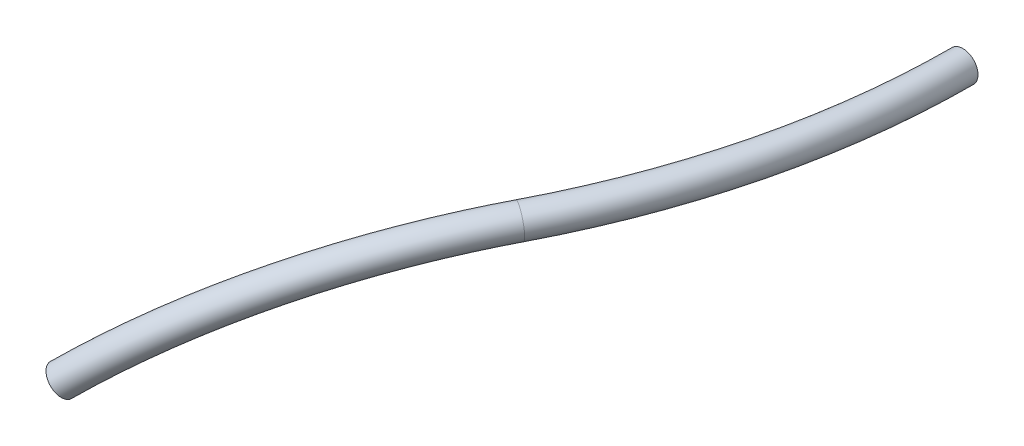
from build123d import *

# Parameters (mm, degrees)
SKETCH1_R = 50.8
SKETCH4_R = 50.8


with BuildPart() as part:
    # Sweep1: sweep along a path in Sketch2
    with BuildLine(Plane(origin=(-767.916933237, 6367.64298763, -2.775e-06), x_dir=(5.179307759717874e-11, -4.294733297799064e-10, -1.0), z_dir=(0.11972922919226148, -0.9928065832159992, 4.325850943793921e-10))) as sweep1_path:
        ThreePointArc((-6.59e-07, 4382.994228049), (-601.46332602, 4297.141782627), (-1154.887361144, 4046.441540334))
    # Sketch1 → Sweep1 (sweep)
    with BuildSketch(Plane.XY):
        with Locations((3583.548590569, 6892.415508108)):
            Circle(SKETCH1_R)
    sweep(path=sweep1_path.line)

    # Sweep2: sweep along a path in Sketch3
    with BuildLine(Plane(origin=(-508.842223618, 360.27262354, -294.287523413), x_dir=(-0.6490943360035849, -0.7226256346086777, 0.237673589560286), z_dir=(0.73805584036661, -0.5225614180307999, 0.4268525985470592))) as sweep2_path:
        ThreePointArc((-6786.209650229, -3509.425060524), (-6336.56498271, -3914.889467469), (-5763.703404849, -4110.877540929))
    # Sketch4 → Sweep2 (sweep)
    with BuildSketch(Plane(origin=(639.856595269, 77.164614258, -1011.887121391), x_dir=(0.8458971833427876, -0.04055421915316704, 0.5318019467072448), z_dir=(-0.5333459995282034, -0.06431978450138558, 0.8434482853791079))):
        with Locations((3084.961531419, 6920.097799055)):
            Circle(SKETCH4_R)
    sweep(path=sweep2_path.line)


solid = part.part
